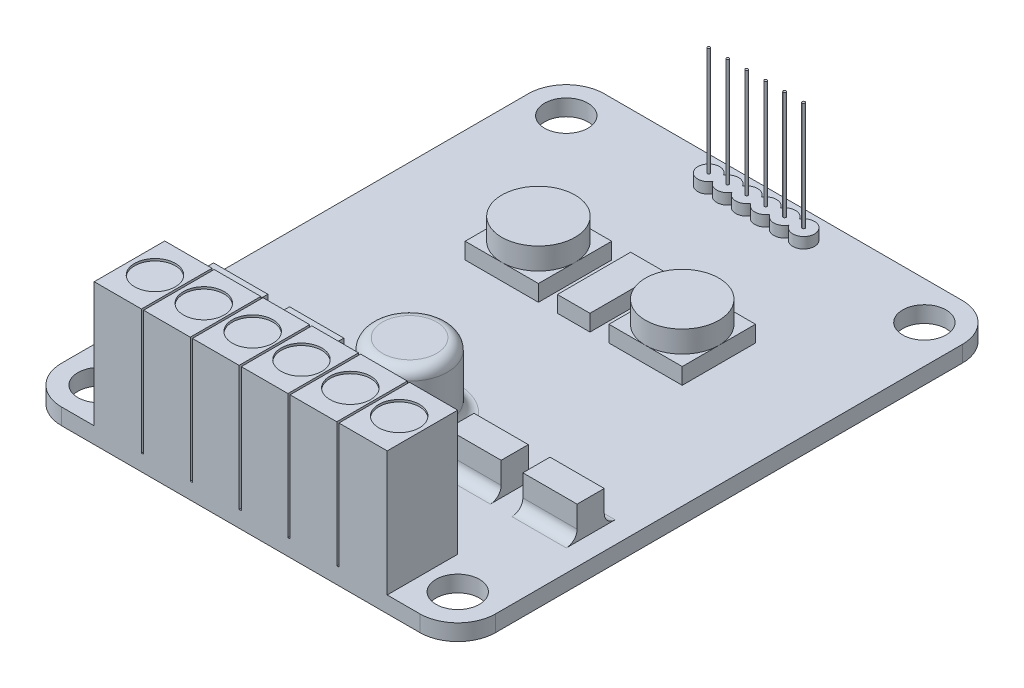
from build123d import *

# Parameters (mm, degrees)
SKETCH1_W           = 40
SKETCH1_H           = 50
BOSS_EXTRUDE1_DEPTH = 1.5
FILLET1_R           = 3.5
SKETCH2_R           = 2
CUT_EXTRUDE1_DEPTH  = 1.5
SKETCH3_W           = 27
SKETCH3_H           = 6.5
BOSS_EXTRUDE2_DEPTH = 11.5
SKETCH4_R           = 1.875
CUT_EXTRUDE2_DEPTH  = 0.2
SKETCH5_W           = 0.2
SKETCH5_H           = 6.5
CUT_EXTRUDE3_DEPTH  = 11.5
SKETCH6_R           = 3.5
BOSS_EXTRUDE3_DEPTH = 6
FILLET2_R           = 1
SKETCH7_W           = 5
SKETCH7_H           = 2.5
BOSS_EXTRUDE4_DEPTH = 3
FILLET3_R           = 1
BOSS_EXTRUDE5_DEPTH = 1
SKETCH9_R           = 0.125
BOSS_EXTRUDE6_DEPTH = 10
SKETCH10_W          = 6.75
SKETCH10_H          = 6.75
SKETCH10_W_2        = 3
BOSS_EXTRUDE7_DEPTH = 1.5
SKETCH11_R          = 3.375
BOSS_EXTRUDE8_DEPTH = 2


with BuildPart() as part:
    # Sketch1 → Boss-Extrude1 (new body)
    with BuildSketch(Plane(origin=(0, 0, 0), x_dir=(1, 0, 0), z_dir=(0, 1, 0))):
        Rectangle(SKETCH1_W, SKETCH1_H)
    extrude(amount=BOSS_EXTRUDE1_DEPTH)

    # Fillet1
    fillet1_edges = [part.edges().sort_by_distance(p)[0] for p in [
        (20, 0.75, 25),
        (-20, 0.75, 25),
        (-20, 0.75, -25),
        (20, 0.75, -25),
    ]]
    fillet(fillet1_edges, radius=FILLET1_R)

    # Sketch2 → Cut-Extrude1 (cut)
    with BuildSketch(Plane(origin=(0, 1.5, 0), x_dir=(1, 0, 0), z_dir=(0, 1, 0))):
        with Locations(Location((-16.5, 21.5, 0), (0, 0, 270))):
            Circle(SKETCH2_R)
        with Locations(Location((16.5, 21.5, 0), (0, 0, 270))):
            Circle(SKETCH2_R)
        with Locations(Location((-16.5, -21.5, 0), (0, 0, 270))):
            Circle(SKETCH2_R)
        with Locations(Location((16.5, -21.5, 0), (0, 0, 270))):
            Circle(SKETCH2_R)
    extrude(amount=-CUT_EXTRUDE1_DEPTH, mode=Mode.SUBTRACT)

    # Sketch3 → Boss-Extrude2 (add)
    with BuildSketch(Plane(origin=(0, 1.5, 0), x_dir=(1, 0, 0), z_dir=(0, 1, 0))):
        with Locations((0, -21.75)):
            Rectangle(SKETCH3_W, SKETCH3_H)
    extrude(amount=BOSS_EXTRUDE2_DEPTH)

    # Sketch4 → Cut-Extrude2 (cut)
    with BuildSketch(Plane(origin=(0, 13, 0), x_dir=(1, 0, 0), z_dir=(0, 1, 0))):
        with Locations(Location((-11.228178801, -21.670447507, 0), (0, 0, 270))):
            Circle(SKETCH4_R)
        with Locations(Location((-6.728178801, -21.670447507, 0), (0, 0, 270))):
            Circle(SKETCH4_R)
        with Locations(Location((-2.228178801, -21.670447507, 0), (0, 0, 270))):
            Circle(SKETCH4_R)
        with Locations(Location((2.271821199, -21.670447507, 0), (0, 0, 270))):
            Circle(SKETCH4_R)
        with Locations(Location((6.771821199, -21.670447507, 0), (0, 0, 270))):
            Circle(SKETCH4_R)
        with Locations(Location((11.271821199, -21.670447507, 0), (0, 0, 270))):
            Circle(SKETCH4_R)
    extrude(amount=-CUT_EXTRUDE2_DEPTH, mode=Mode.SUBTRACT)

    # Sketch5 → Cut-Extrude3 (cut)
    with BuildSketch(Plane(origin=(0, 13, 0), x_dir=(1, 0, 0), z_dir=(0, 1, 0))):
        with Locations((-9.045617119, -21.75)):
            Rectangle(SKETCH5_W, SKETCH5_H)
        with Locations((-4.545617119, -21.75)):
            Rectangle(SKETCH5_W, SKETCH5_H)
        with Locations((-0.045617119, -21.75)):
            Rectangle(SKETCH5_W, SKETCH5_H)
        with Locations((4.454382881, -21.75)):
            Rectangle(SKETCH5_W, SKETCH5_H)
        with Locations((8.954382881, -21.75)):
            Rectangle(SKETCH5_W, SKETCH5_H)
    extrude(amount=-CUT_EXTRUDE3_DEPTH, mode=Mode.SUBTRACT)

    # Sketch6 → Boss-Extrude3 (add)
    with BuildSketch(Plane(origin=(0, 1.5, 0), x_dir=(1, 0, 0), z_dir=(0, 1, 0))):
        with Locations(Location((0, -9.436720639, 0), (0, 0, 270))):
            Circle(SKETCH6_R)
    extrude(amount=BOSS_EXTRUDE3_DEPTH)

    # Fillet2
    fillet2_edges = [part.edges().sort_by_distance(p)[0] for p in [
        (0, 1.5, 5.936720639),
        (0, 7.5, 5.936720639),
    ]]
    fillet(fillet2_edges, radius=FILLET2_R)

    # Sketch7 → Boss-Extrude4 (add)
    with BuildSketch(Plane(origin=(0, 1.5, 0), x_dir=(1, 0, 0), z_dir=(0, 1, 0))):
        with Locations((-8.5, -10.75)):
            Rectangle(SKETCH7_W, SKETCH7_H)
        with Locations((-15.5, -10.75)):
            Rectangle(SKETCH7_W, SKETCH7_H)
        with Locations((8.5, -10.75)):
            Rectangle(SKETCH7_W, SKETCH7_H)
        with Locations((15.5, -10.75)):
            Rectangle(SKETCH7_W, SKETCH7_H)
    extrude(amount=BOSS_EXTRUDE4_DEPTH)

    # Fillet3
    fillet3_edges = [part.edges().sort_by_distance(p)[0] for p in [
        (-8.5, 1.5, 9.5),
        (-8.5, 1.5, 12),
        (-15.5, 1.5, 9.5),
        (-15.5, 1.5, 12),
        (8.5, 1.5, 12),
        (8.5, 1.5, 9.5),
        (15.5, 1.5, 12),
        (15.5, 1.5, 9.5),
    ]]
    fillet(fillet3_edges, radius=FILLET3_R)

    # Sketch8 → Boss-Extrude5 (add)
    with BuildSketch(Plane(origin=(0, 1.5, 0), x_dir=(1, 0, 0), z_dir=(0, 1, 0))):
        with BuildLine():
            ThreePointArc((-3.5, 22.984122918), (-5.375, 22.5), (-3.5, 22.015877082))
            ThreePointArc((-3.5, 22.015877082), (-2.625, 21.5), (-1.75, 22.015877082))
            ThreePointArc((-1.75, 22.015877082), (-0.875, 21.5), (0, 22.015877082))
            ThreePointArc((0, 22.015877082), (0.875, 21.5), (1.75, 22.015877082))
            ThreePointArc((1.75, 22.015877082), (2.625, 21.5), (3.5, 22.015877082))
            ThreePointArc((3.5, 22.015877082), (5.375, 22.5), (3.5, 22.984122918))
            ThreePointArc((3.5, 22.984122918), (2.625, 23.5), (1.75, 22.984122918))
            ThreePointArc((1.75, 22.984122918), (0.875, 23.5), (0, 22.984122918))
            ThreePointArc((0, 22.984122918), (-0.875, 23.5), (-1.75, 22.984122918))
            ThreePointArc((-1.75, 22.984122918), (-2.625, 23.5), (-3.5, 22.984122918))
        make_face()
    extrude(amount=BOSS_EXTRUDE5_DEPTH)

    # Sketch9 → Boss-Extrude6 (add)
    with BuildSketch(Plane(origin=(0, 2.5, 0), x_dir=(1, 0, 0), z_dir=(0, 1, 0))):
        with Locations(Location((-4.375, 22.5, 0), (0, 0, 270))):
            Circle(SKETCH9_R)
        with Locations(Location((-2.625, 22.5, 0), (0, 0, 270))):
            Circle(SKETCH9_R)
        with Locations(Location((-0.875, 22.5, 0), (0, 0, 270))):
            Circle(SKETCH9_R)
        with Locations(Location((0.875, 22.5, 0), (0, 0, 270))):
            Circle(SKETCH9_R)
        with Locations(Location((2.625, 22.5, 0), (0, 0, 270))):
            Circle(SKETCH9_R)
        with Locations(Location((4.375, 22.5, 0), (0, 0, 270))):
            Circle(SKETCH9_R)
    extrude(amount=BOSS_EXTRUDE6_DEPTH)

    # Sketch10 → Boss-Extrude7 (add)
    with BuildSketch(Plane(origin=(0, 1.5, 0), x_dir=(1, 0, 0), z_dir=(0, 1, 0))):
        with Locations((6.987498071, 8.697159078)):
            Rectangle(SKETCH10_W, SKETCH10_H)
        with Locations((0.362498071, 8.697159078)):
            Rectangle(SKETCH10_W_2, SKETCH10_H)
        with Locations((-6.262501929, 8.697159078)):
            Rectangle(SKETCH10_W, SKETCH10_H)
    extrude(amount=BOSS_EXTRUDE7_DEPTH)

    # Sketch11 → Boss-Extrude8 (add)
    with BuildSketch(Plane(origin=(0, 3, 0), x_dir=(1, 0, 0), z_dir=(0, 1, 0))):
        with Locations(Location((-6.262501929, 8.697159078, 0), (0, 0, 270))):
            Circle(SKETCH11_R)
        with Locations(Location((6.987498071, 8.697159078, 0), (0, 0, 270))):
            Circle(SKETCH11_R)
    extrude(amount=BOSS_EXTRUDE8_DEPTH)


solid = part.part
